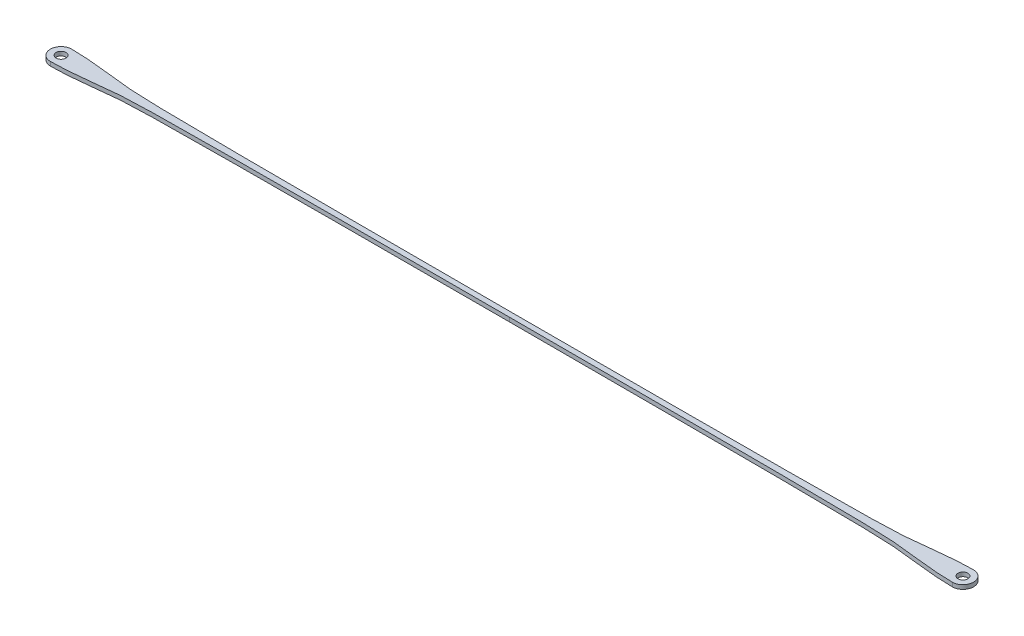
from build123d import *

# Parameters (mm, degrees)
BOSS_EXTRUDE1_DEPTH = 0.5
SKETCH3_R           = 0.6
CUT_EXTRUDE1_DEPTH  = 1


with BuildPart() as part:
    # Sketch2 → Boss-Extrude1 (new body)
    with BuildSketch(Plane(origin=(0, 0, 0), x_dir=(1, 0, 0), z_dir=(0, 1, 0))):
        with BuildLine():
            Line((55, -0.31906631), (55, 0.31906631))
            add(Edge.make_bspline(
                [(0, 1.300005072), (2.158295669, 1.300005072), (7.532558027, 0.546418398), (11.223513642, 0.32825862), (55, 0.31906631)],
                knots=[0, 0, 0, 0, 0.427834461, 1, 1, 1, 1], degree=3))
            ThreePointArc((0, 1.300005072), (0.919242402, 0.919242402), (1.300005072, 0))
            ThreePointArc((1.300005072, 0), (0.919242402, -0.919242402), (0, -1.300005072))
            add(Edge.make_bspline(
                [(0, -1.300005072), (2.158295669, -1.300005072), (7.532558027, -0.546418398), (11.223513642, -0.32825862), (55, -0.31906631)],
                knots=[0, 0, 0, 0, 0.427834461, 1, 1, 1, 1], degree=3))
        make_face()
        with BuildLine():
            ThreePointArc((1.300005072, 0), (0.919242402, 0.919242402), (0, 1.300005072))
            ThreePointArc((0, 1.300005072), (-1.300005072, 0), (0, -1.300005072))
            ThreePointArc((0, -1.300005072), (0.919242402, -0.919242402), (1.300005072, 0))
        make_face()
    boss_extrude1 = extrude(amount=BOSS_EXTRUDE1_DEPTH)

    # Sketch3 → Cut-Extrude1 (cut)
    with BuildSketch(Plane(origin=(0, 0.5, 0), x_dir=(1, 0, 0), z_dir=(0, 1, 0))):
        with Locations(Location((0, 0, 0), (0, 0, 270))):
            Circle(SKETCH3_R)
    cut_extrude1 = extrude(amount=-CUT_EXTRUDE1_DEPTH, mode=Mode.SUBTRACT)

    # Mirror1: Boss-Extrude1, Cut-Extrude1 across plane
    add(boss_extrude1.mirror(Plane(origin=(55, 0, 0), x_dir=(0, 0, 1), z_dir=(1, 0, 0))))
    add(cut_extrude1.mirror(Plane(origin=(55, 0, 0), x_dir=(0, 0, 1), z_dir=(1, 0, 0))), mode=Mode.SUBTRACT)


solid = part.part
